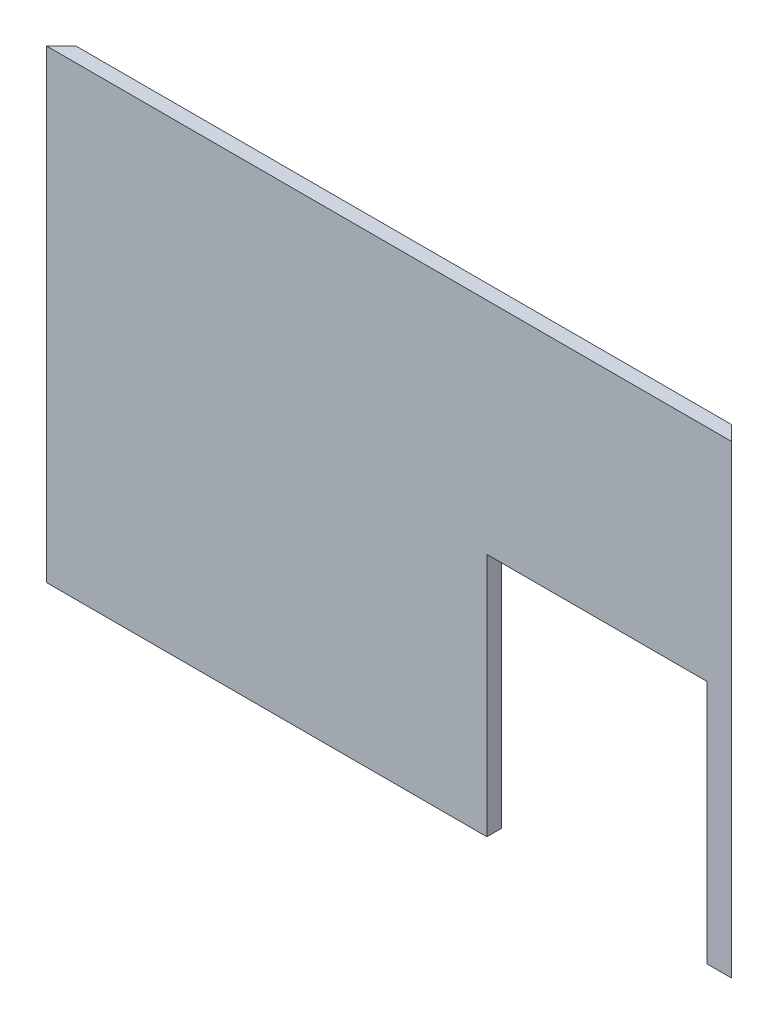
from build123d import *

# Parameters (mm, degrees)
SKETCH1_W           = 140
SKETCH1_H           = 3
BOSS_EXTRUDE1_DEPTH = 95
CUT_EXTRUDE1_DEPTH  = 95
SKETCH4_W           = 45
SKETCH4_H           = 50
CUT_EXTRUDE3_DEPTH  = 10


with BuildPart() as part:
    # Sketch1 → Boss-Extrude1 (new body)
    with BuildSketch(Plane(origin=(0, 0, 0), x_dir=(1, 0, 0), z_dir=(0, 1, 0))):
        Rectangle(SKETCH1_W, SKETCH1_H)
    extrude(amount=BOSS_EXTRUDE1_DEPTH)

    # Sketch 377 → Cut-Extrude1 (cut)
    with BuildSketch(Plane(origin=(0, 95, 0), x_dir=(1, 0, 0), z_dir=(0, 1, 0))):
        Polygon((70, -1.5), (70, 1.5), (67, 1.5), align=None)
        Polygon((-70, -1.5), (-70, 1.5), (-67, 1.5), align=None)
    extrude(amount=-CUT_EXTRUDE1_DEPTH, mode=Mode.SUBTRACT)

    # Sketch4 → Cut-Extrude3 (cut)
    with BuildSketch(Plane.XY.offset(1.5)):
        with Locations((42.5, 25)):
            Rectangle(SKETCH4_W, SKETCH4_H)
    extrude(amount=-CUT_EXTRUDE3_DEPTH, mode=Mode.SUBTRACT)


solid = part.part
